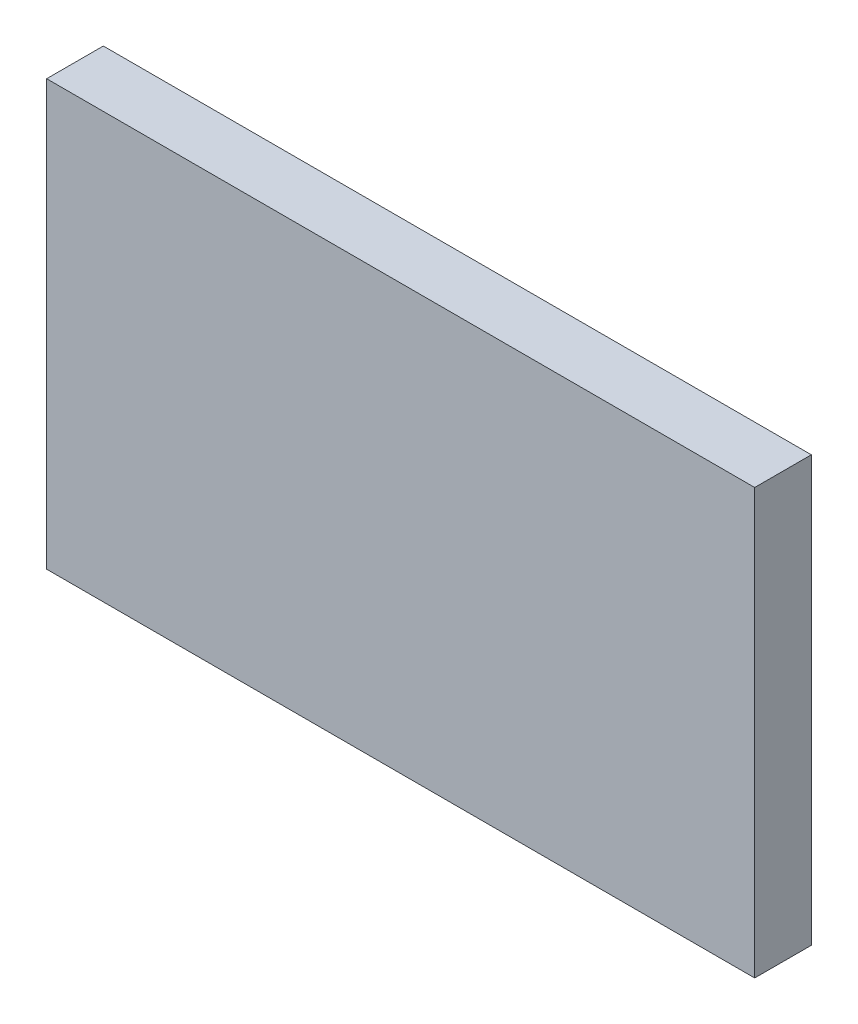
from build123d import *

# Parameters (mm, degrees)
ESQUISSE1_W          = 5000
ESQUISSE1_H          = 3000
BASE_EXTRUSION_DEPTH = 400


with BuildPart() as part:
    # Esquisse1 → Base-Extrusion (new body)
    with BuildSketch(Plane.XY):
        with Locations((2500, 1500)):
            Rectangle(ESQUISSE1_W, ESQUISSE1_H)
    extrude(amount=BASE_EXTRUSION_DEPTH)


solid = part.part
